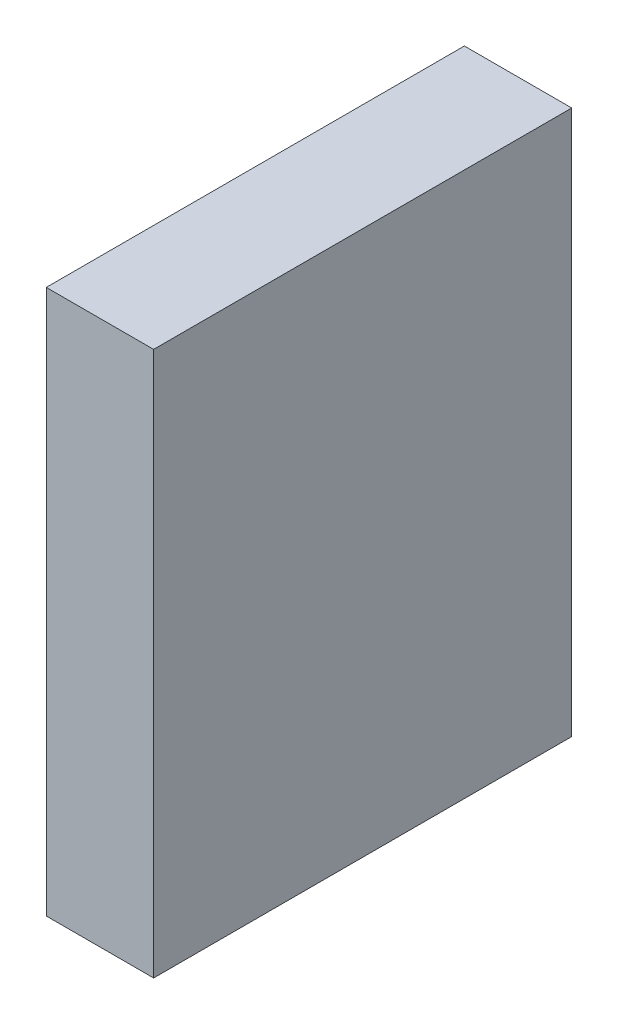
from build123d import *

# Parameters (mm, degrees)
SKETCH1_W           = 20.29
SKETCH1_H           = 26.42
BOSS_EXTRUDE1_DEPTH = 5.21


with BuildPart() as part:
    # Sketch1 → Boss-Extrude1 (new body)
    with BuildSketch(Plane(origin=(0, 0, 0), x_dir=(0, 0, -1), z_dir=(1, 0, 0))):
        Rectangle(SKETCH1_W, SKETCH1_H)
    extrude(amount=BOSS_EXTRUDE1_DEPTH)


solid = part.part
